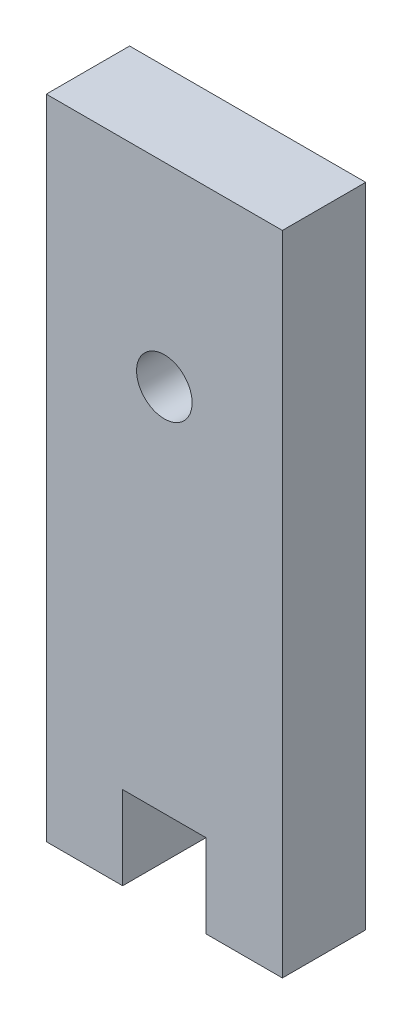
from build123d import *

# Parameters (mm, degrees)
SKETCH2_R           = 1
BOSS_EXTRUDE1_DEPTH = 3


with BuildPart() as part:
    # Sketch2 → Boss-Extrude1 (new body)
    with BuildSketch(Plane.XY):
        Polygon((-2.428559813, -7.443684094), (-2.428559813, 13.056315906), (6.071440187, 13.056315906), (6.071440187, -7.25278389), (6.071440187, -10.25278389), (3.321440187, -10.25278389), (3.321440187, -7.25278389), (0.321440187, -7.25278389), (0.321440187, -10.25278389), (-2.428559813, -10.25278389), align=None)
        with Locations((1.821440187, 6.056315906)):
            Circle(SKETCH2_R, mode=Mode.SUBTRACT)
    extrude(amount=BOSS_EXTRUDE1_DEPTH)


solid = part.part
